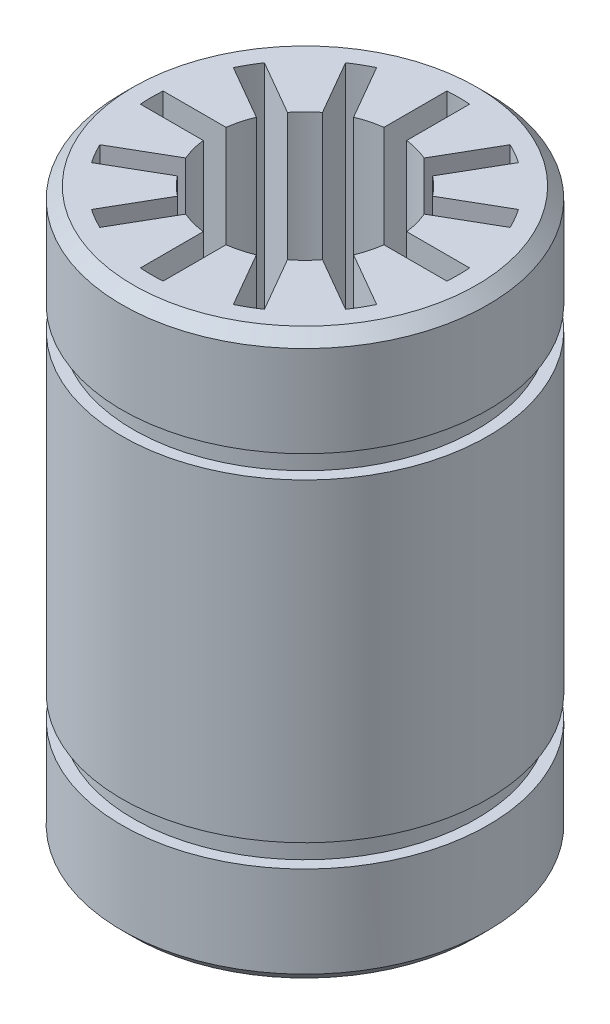
from build123d import *

# Parameters (mm, degrees)
CHANFREIN1_SIZE         = 0.5
ENL_V_MAT_EXTRU_1_DEPTH = 28.28126444


with BuildPart() as part:
    # Esquisse2 → Révolution1 (revolve)
    with BuildSketch(Plane.XY):
        Polygon((0, 12.4), (-8.03826441, 12.4), (-8.03826441, 7.9), (-7.53826441, 7.9), (-7.53826441, 6.9), (-8.03826441, 6.9), (-8.03826441, -6.9), (-7.53826441, -6.9), (-7.53826441, -7.9), (-8.03826441, -7.9), (-8.03826441, -12.4), (0, -12.4), align=None)
    revolve(axis=Axis((0, 0, 0), (0, -1, 0)))

    # Chanfrein1
    chanfrein1_edges = [part.edges().sort_by_distance(p)[0] for p in [
        (8.03826441, 12.4, 0),
        (8.03826441, -12.4, 0),
    ]]
    chamfer(chanfrein1_edges, length=CHANFREIN1_SIZE)

    # Esquisse3 → Enlèv. mat.-Extru.1 (cut, through all)
    with BuildSketch(Plane(origin=(0, 12.4, 0), x_dir=(1, 0, 0), z_dir=(0, 1, 0))):
        with BuildLine():
            Line((-0.5, 6.731456009), (-0.5, 3.968626967))
            ThreePointArc((-0.5, 3.968626967), (-1.03527618, 3.863703305), (-1.551300781, 3.686931771))
            Line((-1.551300781, 3.686931771), (-2.932715303, 6.079611908))
            ThreePointArc((-2.932715303, 6.079611908), (-3.375, 5.845671476), (-3.798740706, 5.579611908))
            Line((-3.798740706, 5.579611908), (-2.417326185, 3.186931771))
            ThreePointArc((-2.417326185, 3.186931771), (-2.828427125, 2.828427125), (-3.186931771, 2.417326185))
            Line((-3.186931771, 2.417326185), (-5.579611908, 3.798740706))
            ThreePointArc((-5.579611908, 3.798740706), (-5.845671476, 3.375), (-6.079611908, 2.932715303))
            Line((-6.079611908, 2.932715303), (-3.686931771, 1.551300781))
            ThreePointArc((-3.686931771, 1.551300781), (-3.863703305, 1.03527618), (-3.968626967, 0.5))
            Line((-3.968626967, 0.5), (-6.731456009, 0.5))
            ThreePointArc((-6.731456009, 0.5), (-6.75, 0), (-6.731456009, -0.5))
            Line((-6.731456009, -0.5), (-3.968626967, -0.5))
            ThreePointArc((-3.968626967, -0.5), (-3.863703305, -1.03527618), (-3.686931771, -1.551300781))
            Line((-3.686931771, -1.551300781), (-6.079611908, -2.932715303))
            ThreePointArc((-6.079611908, -2.932715303), (-5.845671476, -3.375), (-5.579611908, -3.798740706))
            Line((-5.579611908, -3.798740706), (-3.186931771, -2.417326185))
            ThreePointArc((-3.186931771, -2.417326185), (-2.828427125, -2.828427125), (-2.417326185, -3.186931771))
            Line((-2.417326185, -3.186931771), (-3.798740706, -5.579611908))
            ThreePointArc((-3.798740706, -5.579611908), (-3.375, -5.845671476), (-2.932715303, -6.079611908))
            Line((-2.932715303, -6.079611908), (-1.551300781, -3.686931771))
            ThreePointArc((-1.551300781, -3.686931771), (-1.03527618, -3.863703305), (-0.5, -3.968626967))
            Line((-0.5, -3.968626967), (-0.5, -6.731456009))
            ThreePointArc((-0.5, -6.731456009), (0, -6.75), (0.5, -6.731456009))
            Line((0.5, -6.731456009), (0.5, -3.968626967))
            ThreePointArc((0.5, -3.968626967), (1.03527618, -3.863703305), (1.551300781, -3.686931771))
            Line((1.551300781, -3.686931771), (2.932715303, -6.079611908))
            ThreePointArc((2.932715303, -6.079611908), (3.375, -5.845671476), (3.798740706, -5.579611908))
            Line((3.798740706, -5.579611908), (2.417326185, -3.186931771))
            ThreePointArc((2.417326185, -3.186931771), (2.828427125, -2.828427125), (3.186931771, -2.417326185))
            Line((3.186931771, -2.417326185), (5.579611908, -3.798740706))
            ThreePointArc((5.579611908, -3.798740706), (5.845671476, -3.375), (6.079611908, -2.932715303))
            Line((6.079611908, -2.932715303), (3.686931771, -1.551300781))
            ThreePointArc((3.686931771, -1.551300781), (3.863703305, -1.03527618), (3.968626967, -0.5))
            Line((3.968626967, -0.5), (6.731456009, -0.5))
            ThreePointArc((6.731456009, -0.5), (6.75, 0), (6.731456009, 0.5))
            Line((6.731456009, 0.5), (3.968626967, 0.5))
            ThreePointArc((3.968626967, 0.5), (3.863703305, 1.03527618), (3.686931771, 1.551300781))
            Line((3.686931771, 1.551300781), (6.079611908, 2.932715303))
            ThreePointArc((6.079611908, 2.932715303), (5.845671476, 3.375), (5.579611908, 3.798740706))
            Line((5.579611908, 3.798740706), (3.186931771, 2.417326185))
            ThreePointArc((3.186931771, 2.417326185), (2.828427125, 2.828427125), (2.417326185, 3.186931771))
            Line((2.417326185, 3.186931771), (3.798740706, 5.579611908))
            ThreePointArc((3.798740706, 5.579611908), (3.375, 5.845671476), (2.932715303, 6.079611908))
            Line((2.932715303, 6.079611908), (1.551300781, 3.686931771))
            ThreePointArc((1.551300781, 3.686931771), (1.03527618, 3.863703305), (0.5, 3.968626967))
            Line((0.5, 3.968626967), (0.5, 6.731456009))
            ThreePointArc((0.5, 6.731456009), (0, 6.75), (-0.5, 6.731456009))
        make_face()
    extrude(amount=-ENL_V_MAT_EXTRU_1_DEPTH, mode=Mode.SUBTRACT)


solid = part.part
